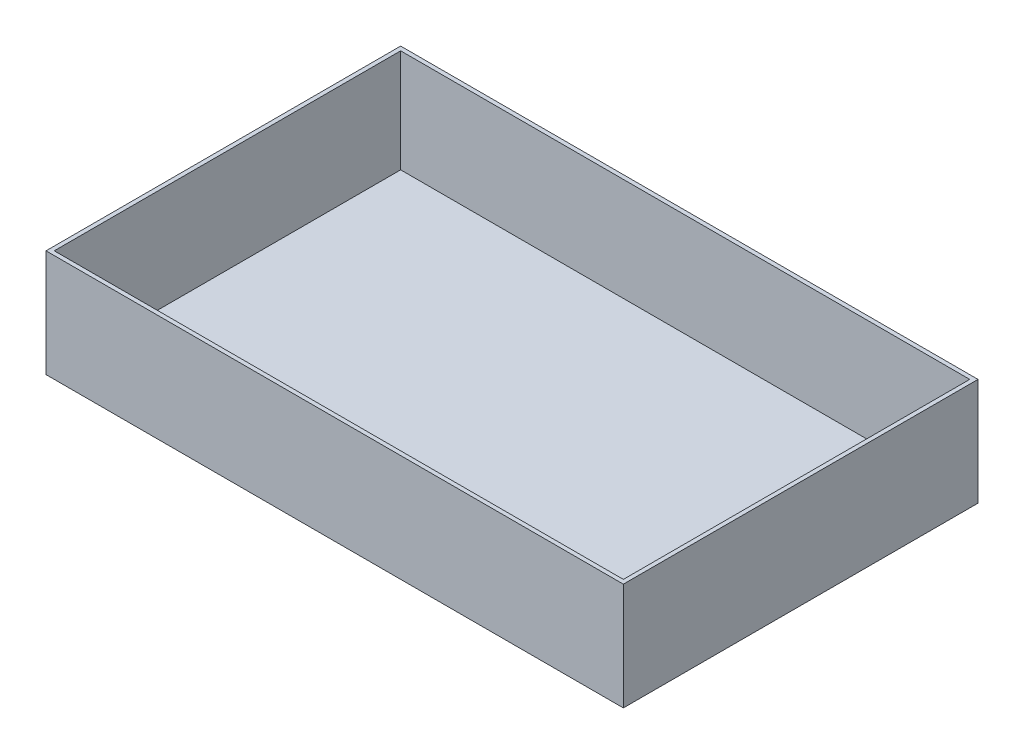
from build123d import *

# Parameters (mm, degrees)
SKETCH1_W           = 700
SKETCH1_H           = 430
BOSS_EXTRUDE1_DEPTH = 130
SHELL2_T            = -5


with BuildPart() as part:
    # Sketch1 → Boss-Extrude1 (new body)
    with BuildSketch(Plane(origin=(0, 0, 0), x_dir=(1, 0, 0), z_dir=(0, 1, 0))):
        Rectangle(SKETCH1_W, SKETCH1_H)
    extrude(amount=BOSS_EXTRUDE1_DEPTH)

    # Shell2
    shell2_openings = [part.faces().sort_by_distance(p)[0] for p in [
        (0, 130, 0),
    ]]
    offset(amount=SHELL2_T, openings=shell2_openings, kind=Kind.INTERSECTION)


solid = part.part
